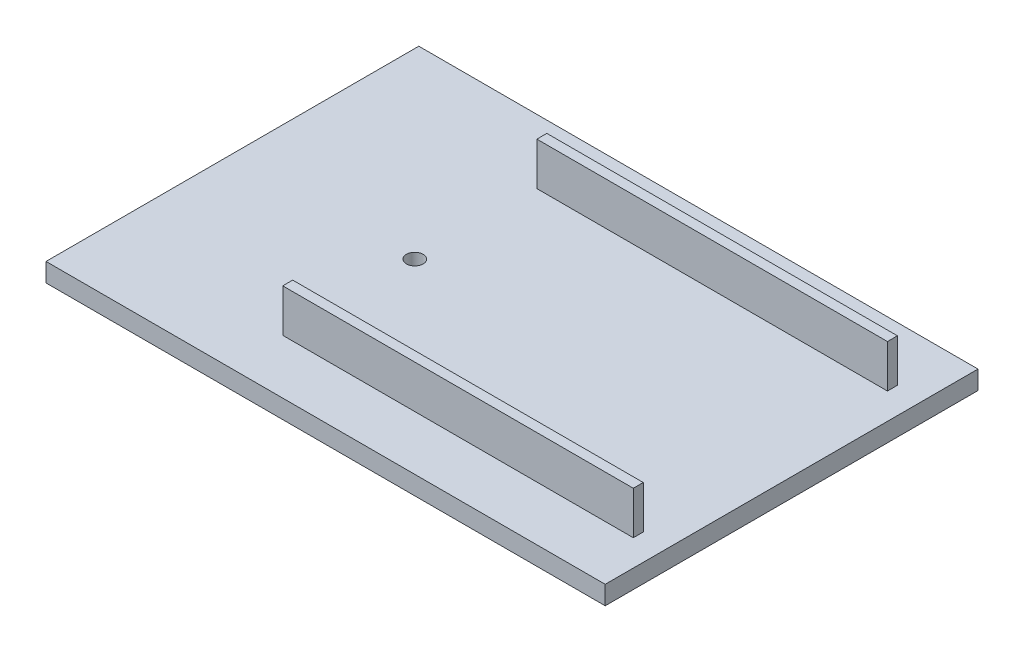
from build123d import *

# Parameters (mm, degrees)
SKETCH1_W           = 300
SKETCH1_H           = 200
BOSS_EXTRUDE1_DEPTH = 10
SKETCH2_R           = 4.5
CUT_EXTRUDE1_DEPTH  = 7
SKETCH3_W           = 188.071582903
SKETCH3_H           = 5.337669468
BOSS_EXTRUDE2_DEPTH = 30


with BuildPart() as part:
    # Sketch1 → Boss-Extrude1 (new body)
    with BuildSketch(Plane(origin=(0, 0, 0), x_dir=(1, 0, 0), z_dir=(0, 1, 0))):
        Rectangle(SKETCH1_W, SKETCH1_H)
    extrude(amount=BOSS_EXTRUDE1_DEPTH)

    # Sketch2 → Cut-Extrude1 (cut)
    with BuildSketch(Plane(origin=(0, 10, 0), x_dir=(1, 0, 0), z_dir=(0, 1, 0))):
        with Locations(Location((-52.149355232, 0, 0), (0, 0, 270))):
            Circle(SKETCH2_R)
    extrude(amount=-CUT_EXTRUDE1_DEPTH, mode=Mode.SUBTRACT)

    # Sketch3 → Boss-Extrude2 (add)
    with BuildSketch(Plane(origin=(0, 3, 0), x_dir=(1, 0, 0), z_dir=(0, 1, 0))):
        with Locations((41.886436219, -68.168834734)):
            Rectangle(SKETCH3_W, SKETCH3_H)
        with Locations((41.886436219, 68.168834734)):
            Rectangle(SKETCH3_W, SKETCH3_H)
    extrude(amount=BOSS_EXTRUDE2_DEPTH)


solid = part.part
